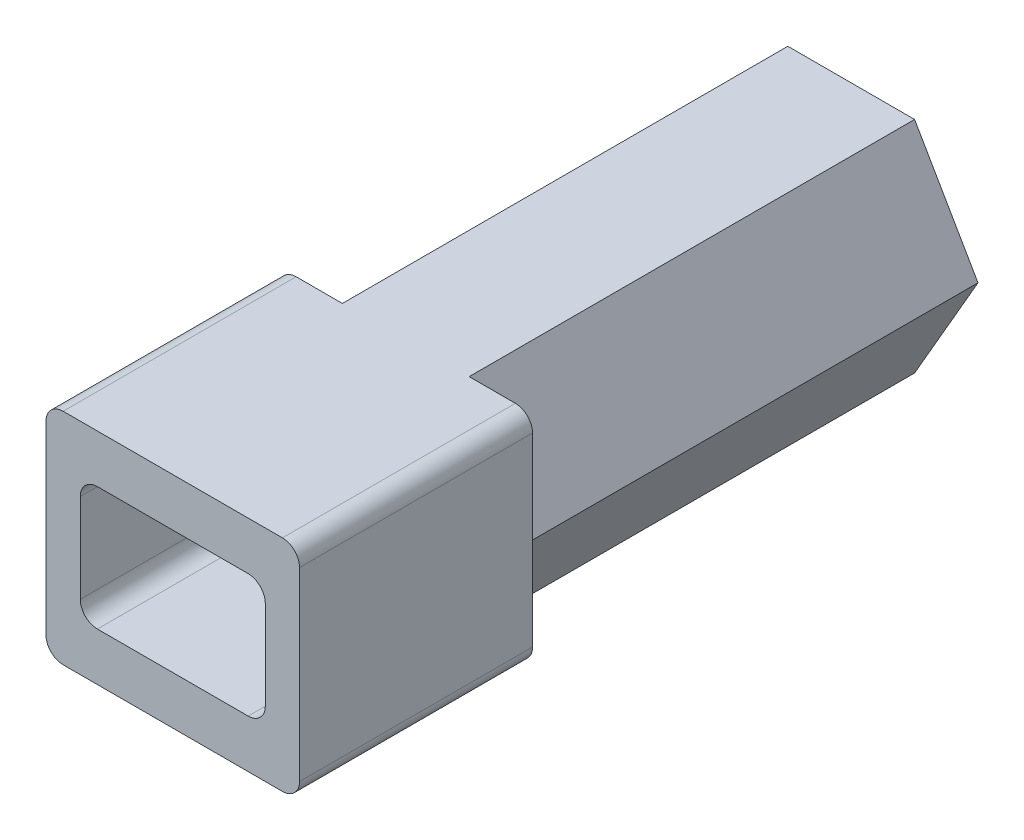
from build123d import *

# Parameters (mm, degrees)
Y_KSEKLIK_EKSTR_ZYON1_DEPTH = 13
Y_KSEKLIK_EKSTR_ZYON2_DEPTH = 6.8
IZIM3_R                     = 1.25
KES_EKSTR_ZYON1_DEPTH       = 13.8


with BuildPart() as part:
    # Çizim1 → Yükseklik-Ekstrüzyon1 (new body)
    with BuildSketch(Plane.XY):
        Polygon((3.7, 0), (1.85, 3.204293994), (-1.85, 3.204293994), (-3.7, 0), (-1.85, -3.204293994), (1.85, -3.204293994), align=None)
    extrude(amount=Y_KSEKLIK_EKSTR_ZYON1_DEPTH)

    # Çizim2 → Yükseklik-Ekstrüzyon2 (add)
    with BuildSketch(Plane.XY.offset(13)):
        with BuildLine():
            Line((1.85, -3.204293994), (3.2, -3.204293994))
            ThreePointArc((3.2, -3.204293994), (3.553553391, -3.057847385), (3.7, -2.704293994))
            Line((3.7, -2.704293994), (3.7, -2))
            Line((3.7, -2), (3.7, 2.325966452))
            Line((3.7, 2.325966452), (3.7, 2.704293994))
            ThreePointArc((3.7, 2.704293994), (3.553553391, 3.057847385), (3.2, 3.204293994))
            Line((3.2, 3.204293994), (1.85, 3.204293994))
            Line((1.85, 3.204293994), (-1.85, 3.204293994))
            Line((-1.85, 3.204293994), (-3.2, 3.204293994))
            ThreePointArc((-3.2, 3.204293994), (-3.553553391, 3.057847385), (-3.7, 2.704293994))
            Line((-3.7, 2.704293994), (-3.7, 2.328172496))
            Line((-3.7, 2.328172496), (-3.7, -2))
            Line((-3.7, -2), (-3.7, -2.704293994))
            ThreePointArc((-3.7, -2.704293994), (-3.553553391, -3.057847385), (-3.2, -3.204293994))
            Line((-3.2, -3.204293994), (-1.85, -3.204293994))
            Line((-1.85, -3.204293994), (1.85, -3.204293994))
        make_face()
        with BuildLine():
            Line((-2.2, -1.8), (2.2, -1.8))
            ThreePointArc((2.2, -1.8), (2.553553391, -1.653553391), (2.7, -1.3))
            Line((2.7, -1.3), (2.7, 1.3))
            ThreePointArc((2.7, 1.3), (2.553553391, 1.653553391), (2.2, 1.8))
            Line((2.2, 1.8), (-2.2, 1.8))
            ThreePointArc((-2.2, 1.8), (-2.553553391, 1.653553391), (-2.7, 1.3))
            Line((-2.7, 1.3), (-2.7, -1.3))
            ThreePointArc((-2.7, -1.3), (-2.553553391, -1.653553391), (-2.2, -1.8))
        make_face(mode=Mode.SUBTRACT)
    extrude(amount=Y_KSEKLIK_EKSTR_ZYON2_DEPTH)

    # Çizim3 → Kes-Ekstrüzyon1 (cut)
    with BuildSketch(Plane(origin=(0, 0, 0), x_dir=(-1, 0, 0), z_dir=(0, 0, -1))):
        Circle(IZIM3_R)
    extrude(amount=-KES_EKSTR_ZYON1_DEPTH, mode=Mode.SUBTRACT)


solid = part.part
